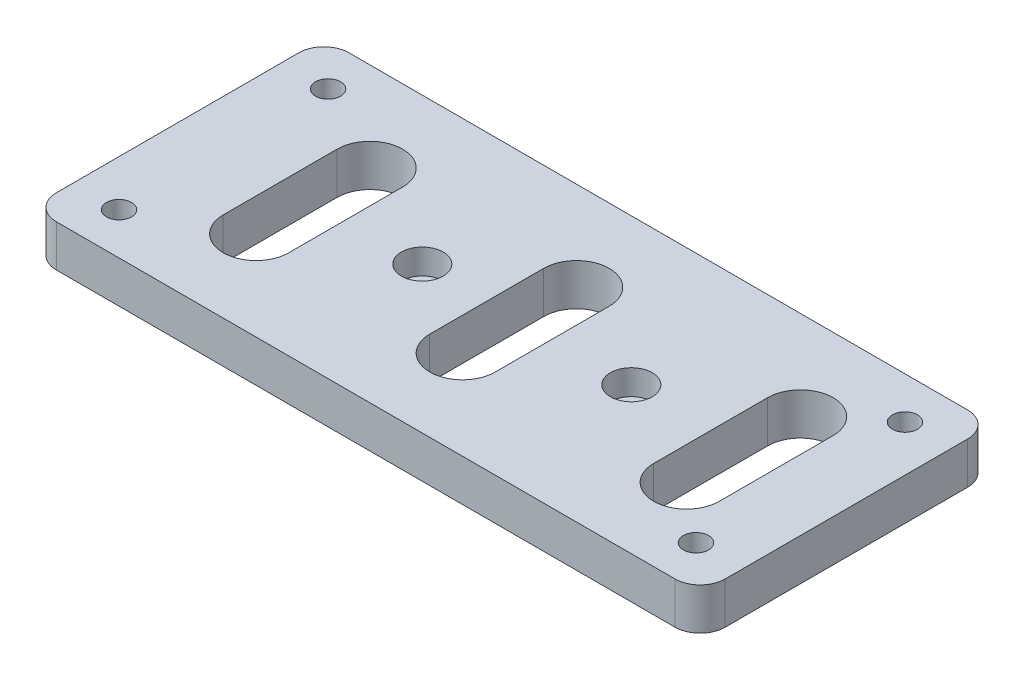
from build123d import *

# Parameters (mm, degrees)
ESQUISSE1_W             = 80
ESQUISSE1_H             = 35
BOSS_EXTRU_1_DEPTH      = 5
ESQUISSE2_R             = 1.5
ESQUISSE2_R_2           = 1.3
ENL_V_MAT_EXTRU_1_DEPTH = 88.464278423
ESQUISSE4_R             = 2.5
ENL_V_MAT_EXTRU_2_DEPTH = 3
CONG_1_R                = 3


with BuildPart() as part:
    # Esquisse1 → Boss.-Extru.1 (new body)
    with BuildSketch(Plane(origin=(0, 0, 0), x_dir=(1, 0, 0), z_dir=(0, 1, 0))):
        with Locations((40, 17.5)):
            Rectangle(ESQUISSE1_W, ESQUISSE1_H)
    extrude(amount=BOSS_EXTRU_1_DEPTH)

    # Esquisse2 → Enlèv. mat.-Extru.1 (cut, through all)
    with BuildSketch(Plane(origin=(0, 5, 0), x_dir=(1, 0, 0), z_dir=(0, 1, 0))):
        with Locations(Location((5.5, 30, 0), (0, 0, 270))):
            Circle(ESQUISSE2_R)
        with Locations(Location((74.5, 30, 0), (0, 0, 270))):
            Circle(ESQUISSE2_R)
        with Locations(Location((29.270489512, 17.5, 0), (0, 0, 270))):
            Circle(ESQUISSE2_R_2)
        with Locations(Location((54.270489512, 17.5, 0), (0, 0, 270))):
            Circle(ESQUISSE2_R_2)
        with Locations(Location((74.5, 5, 0), (0, 0, 270))):
            Circle(ESQUISSE2_R)
        with Locations(Location((5.5, 5, 0), (0, 0, 270))):
            Circle(ESQUISSE2_R)
        with BuildLine():
            Line((71.602501664, 24.310381411), (71.602501664, 10.689618589))
            ThreePointArc((71.602501664, 10.689618589), (67.680448662, 6.767565587), (63.75839566, 10.689618589))
            Line((63.75839566, 10.689618589), (63.75839566, 24.310381411))
            ThreePointArc((63.75839566, 24.310381411), (67.680448662, 28.232434413), (71.602501664, 24.310381411))
        make_face()
        with BuildLine():
            Line((44.815714141, 24.310381411), (44.815714141, 10.689618589))
            ThreePointArc((44.815714141, 10.689618589), (40.893661139, 6.767565587), (36.971608137, 10.689618589))
            Line((36.971608137, 10.689618589), (36.971608137, 24.310381411))
            ThreePointArc((36.971608137, 24.310381411), (40.893661139, 28.232434413), (44.815714141, 24.310381411))
        make_face()
        with BuildLine():
            Line((20.115125023, 24.310381411), (20.115125023, 10.689618589))
            ThreePointArc((20.115125023, 10.689618589), (16.193072021, 6.767565587), (12.271019019, 10.689618589))
            Line((12.271019019, 10.689618589), (12.271019019, 24.310381411))
            ThreePointArc((12.271019019, 24.310381411), (16.193072021, 28.232434413), (20.115125023, 24.310381411))
        make_face()
    extrude(amount=-ENL_V_MAT_EXTRU_1_DEPTH, mode=Mode.SUBTRACT)

    # Esquisse4 → Enlèv. mat.-Extru.2 (cut)
    with BuildSketch(Plane(origin=(0, 5, 0), x_dir=(1, 0, 0), z_dir=(0, 1, 0))):
        with Locations(Location((29.270489512, 17.5, 0), (0, 0, 270))):
            Circle(ESQUISSE4_R)
        with Locations(Location((54.270489512, 17.5, 0), (0, 0, 270))):
            Circle(ESQUISSE4_R)
    extrude(amount=-ENL_V_MAT_EXTRU_2_DEPTH, mode=Mode.SUBTRACT)

    # Congé1
    cong_1_edges = [part.edges().sort_by_distance(p)[0] for p in [
        (0, 2.5, -35),
        (80, 2.5, -35),
        (80, 2.5, 0),
        (0, 2.5, 0),
    ]]
    fillet(cong_1_edges, radius=CONG_1_R)


solid = part.part
